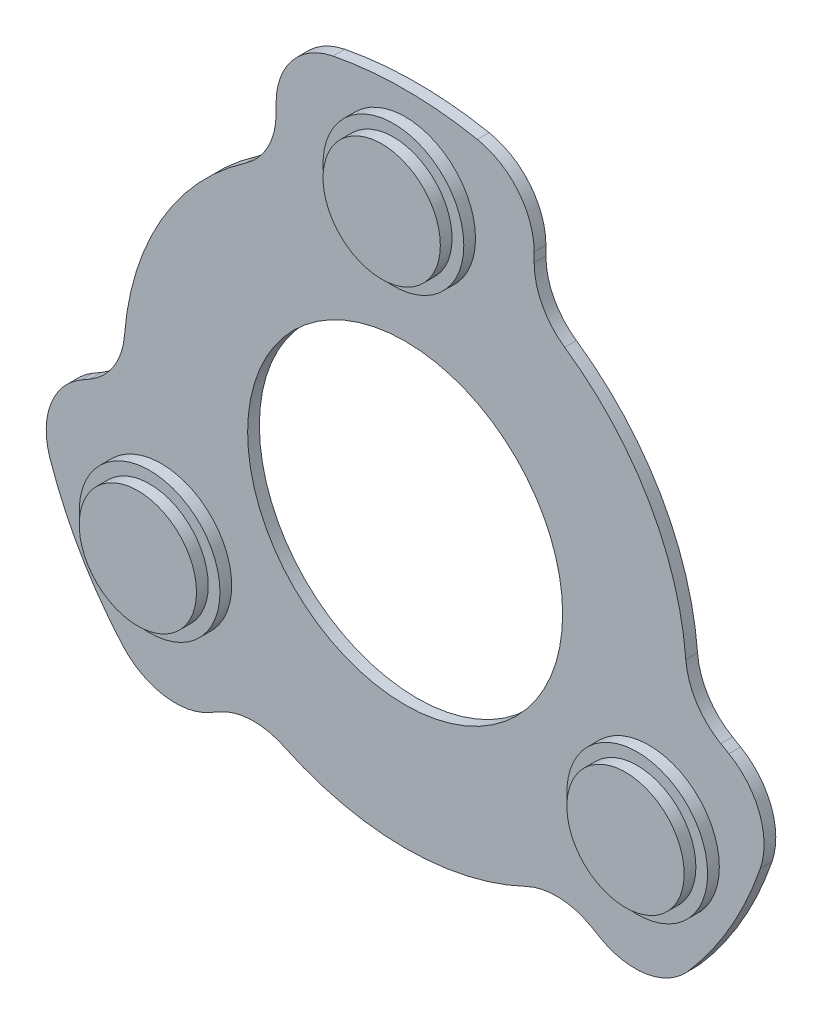
from build123d import *

# Parameters (mm, degrees)
SKETCH9_R           = 13.427276503
SKETCH9_R_2         = 5
BOSS_EXTRUDE1_DEPTH = 1
FILLET1_R           = 6
BOSS_EXTRUDE2_START = -3
SKETCH14_R          = 5
BOSS_EXTRUDE2_DEPTH = 5
BOSS_EXTRUDE3_START = -2
SKETCH15_R          = 6
BOSS_EXTRUDE3_DEPTH = 3
CIRPATTERN1_COUNT   = 3


with BuildPart() as part:
    # Sketch9 → Boss-Extrude1 (new body)
    with BuildSketch(Plane.XY):
        with BuildLine():
            Line((-11, 30.049958403), (-11, 21.330729008))
            ThreePointArc((-11, 21.330729008), (-20.784609691, 12), (-23.972953202, -1.139085062))
            Line((-23.972953202, -1.139085062), (-31.524027359, -5.49869976))
            ThreePointArc((-31.524027359, -5.49869976), (-27.712812921, -16), (-20.524027359, -24.551258643))
            Line((-20.524027359, -24.551258643), (-12.972953202, -20.191643945))
            ThreePointArc((-12.972953202, -20.191643945), (0, -24), (12.972953202, -20.191643945))
            Line((12.972953202, -20.191643945), (20.524027359, -24.551258643))
            ThreePointArc((20.524027359, -24.551258643), (27.712812921, -16), (31.524027359, -5.49869976))
            Line((31.524027359, -5.49869976), (23.972953202, -1.139085062))
            ThreePointArc((23.972953202, -1.139085062), (20.784609691, 12), (11, 21.330729008))
            Line((11, 21.330729008), (11, 30.049958403))
            ThreePointArc((11, 30.049958403), (0, 32), (-11, 30.049958403))
        make_face()
        Circle(SKETCH9_R, mode=Mode.SUBTRACT)
        with Locations((0, 24)):
            Circle(SKETCH9_R_2, mode=Mode.SUBTRACT)
        with Locations((20.784609691, -12)):
            Circle(SKETCH9_R_2, mode=Mode.SUBTRACT)
        with Locations((-20.784609691, -12)):
            Circle(SKETCH9_R_2, mode=Mode.SUBTRACT)
    extrude(amount=BOSS_EXTRUDE1_DEPTH)

    # Fillet1
    fillet1_edges = [part.edges().sort_by_distance(p)[0] for p in [
        (11, 30.049958403, 0.5),
        (11, 21.330729008, 0.5),
        (23.972953202, -1.139085062, 0.5),
        (31.524027359, -5.49869976, 0.5),
        (20.524027359, -24.551258643, 0.5),
        (12.972953202, -20.191643945, 0.5),
        (-12.972953202, -20.191643945, 0.5),
        (-20.524027359, -24.551258643, 0.5),
        (-31.524027359, -5.49869976, 0.5),
        (-23.972953202, -1.139085062, 0.5),
        (-11, 21.330729008, 0.5),
        (-11, 30.049958403, 0.5),
    ]]
    fillet(fillet1_edges, radius=FILLET1_R)

    # Sketch14 → Boss-Extrude2 (add)
    with BuildSketch(Plane.XY.offset(1).offset(BOSS_EXTRUDE2_START)):
        with Locations((0, 24)):
            Circle(SKETCH14_R)
    boss_extrude2 = extrude(amount=BOSS_EXTRUDE2_DEPTH)

    # Sketch15 → Boss-Extrude3 (add)
    with BuildSketch(Plane.XY.offset(1).offset(BOSS_EXTRUDE3_START)):
        with Locations((0, 24)):
            Circle(SKETCH15_R)
    boss_extrude3 = extrude(amount=BOSS_EXTRUDE3_DEPTH)

    # CirPattern1: Boss-Extrude2, Boss-Extrude3 ×3 about axis
    cirpattern1_axis = Axis((0, 0, 0), (0, 0, 1))
    add([boss_extrude2.rotate(cirpattern1_axis, i * 360 / CIRPATTERN1_COUNT) for i in range(1, CIRPATTERN1_COUNT)])
    add([boss_extrude3.rotate(cirpattern1_axis, i * 360 / CIRPATTERN1_COUNT) for i in range(1, CIRPATTERN1_COUNT)])


solid = part.part
